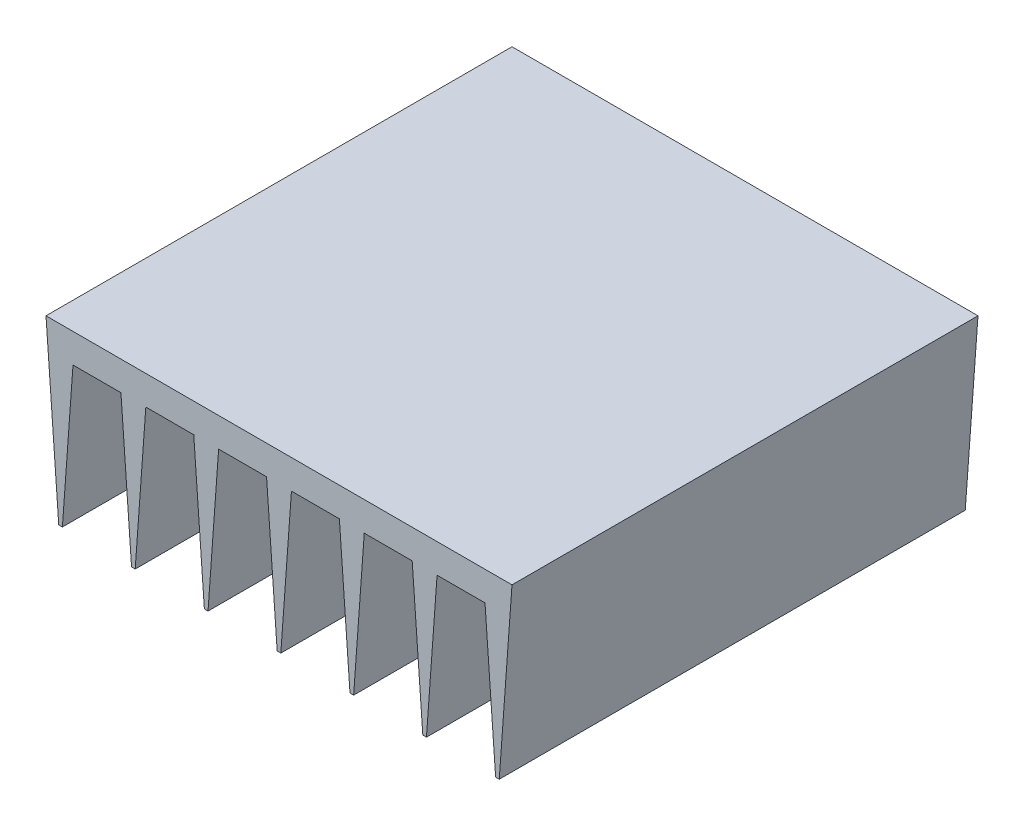
from build123d import *

# Parameters (mm, degrees)
BOSS_EXTRUDE1_DEPTH = 25.4


with BuildPart() as part:
    # Sketch1 → Boss-Extrude1 (new, symmetric)
    with BuildSketch(Plane.XY):
        Polygon((-25.4, 0), (-24.0109375, -19.05), (-23.6140625, -19.05), (-22.456510417, -3.175), (-17.230989583, -3.175), (-16.0734375, -19.05), (-15.6765625, -19.05), (-14.519010417, -3.175), (-9.293489583, -3.175), (-8.1359375, -19.05), (-7.7390625, -19.05), (-6.581510417, -3.175), (-1.355989583, -3.175), (-0.1984375, -19.05), (0.1984375, -19.05), (1.355989583, -3.175), (6.581510417, -3.175), (7.7390625, -19.05), (8.1359375, -19.05), (9.293489583, -3.175), (14.519010417, -3.175), (15.6765625, -19.05), (16.0734375, -19.05), (17.230989583, -3.175), (22.456510417, -3.175), (23.6140625, -19.05), (24.0109375, -19.05), (25.4, 0), align=None)
    extrude(amount=BOSS_EXTRUDE1_DEPTH, both=True)


solid = part.part
